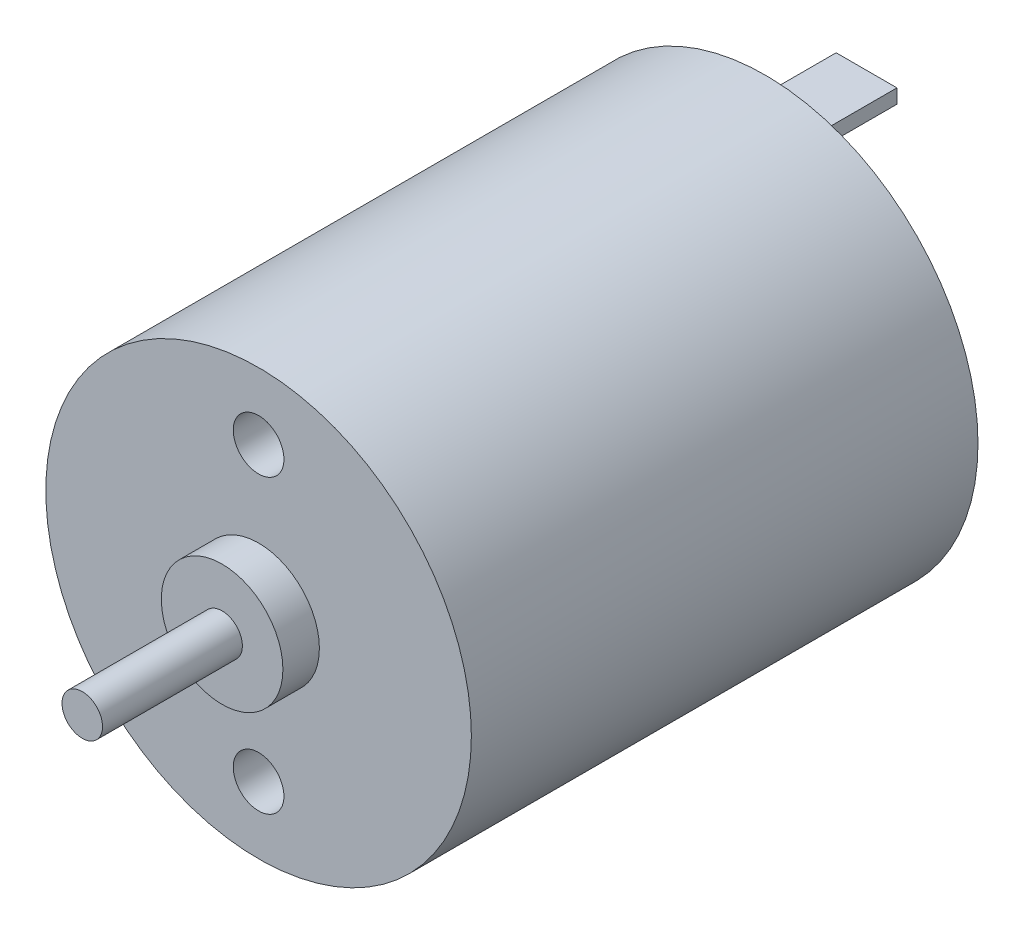
from build123d import *

# Parameters (mm, degrees)
SKETCH_1_R          = 10.5
EXTRUDE_1_DEPTH     = 25
SKETCH_2_R          = 3
EXTRUDE_2_DEPTH     = 1.8
EXTRUDE_START       = -1.8
SKETCH_3_R          = 1
EXTRUDE_3_DEPTH     = 8.7
EXTRUDE_START_2     = -27.6
SKETCH_2_2_R        = 3
EXTRUDE_4_DEPTH     = 2.6
SKETCH_4_W          = 3
SKETCH_4_H          = 0.7
EXTRUDE_5_DEPTH     = 5
SKETCH_5_R          = 1.25
CUT_EXTRUDE_1_DEPTH = 5


with BuildPart() as part:
    # 草图1 → 凸台-拉伸1 (new body)
    with BuildSketch(Plane.XY):
        Circle(SKETCH_1_R)
    extrude(amount=EXTRUDE_1_DEPTH)

    # 草图2 → 凸台-拉伸2 (add)
    with BuildSketch(Plane.XY.offset(25)):
        Circle(SKETCH_2_R)
    extrude(amount=EXTRUDE_2_DEPTH)

    # 草图3 → 凸台-拉伸3 (add)
    with BuildSketch(Plane.XY.offset(26.8).offset(EXTRUDE_START)):
        Circle(SKETCH_3_R)
    extrude(amount=EXTRUDE_3_DEPTH)

    # 草图2<2> → 凸台-拉伸4 (add)
    with BuildSketch(Plane.XY.offset(25).offset(EXTRUDE_START_2)):
        Circle(SKETCH_2_2_R)
    extrude(amount=EXTRUDE_4_DEPTH)

    # 草图4 → 凸台-拉伸5 (add)
    with BuildSketch(Plane(origin=(0, 0, 0), x_dir=(-1, 0, 0), z_dir=(0, 0, -1))):
        with Locations((0, 7.85)):
            Rectangle(SKETCH_4_W, SKETCH_4_H)
        with Locations((0, -7.85)):
            Rectangle(SKETCH_4_W, SKETCH_4_H)
    extrude(amount=EXTRUDE_5_DEPTH)

    # 草图5 → 切除-拉伸1 (cut)
    with BuildSketch(Plane.XY.offset(25)):
        with Locations((0, 7.2)):
            Circle(SKETCH_5_R)
        with Locations((0, -7.2)):
            Circle(SKETCH_5_R)
    extrude(amount=-CUT_EXTRUDE_1_DEPTH, mode=Mode.SUBTRACT)


solid = part.part
